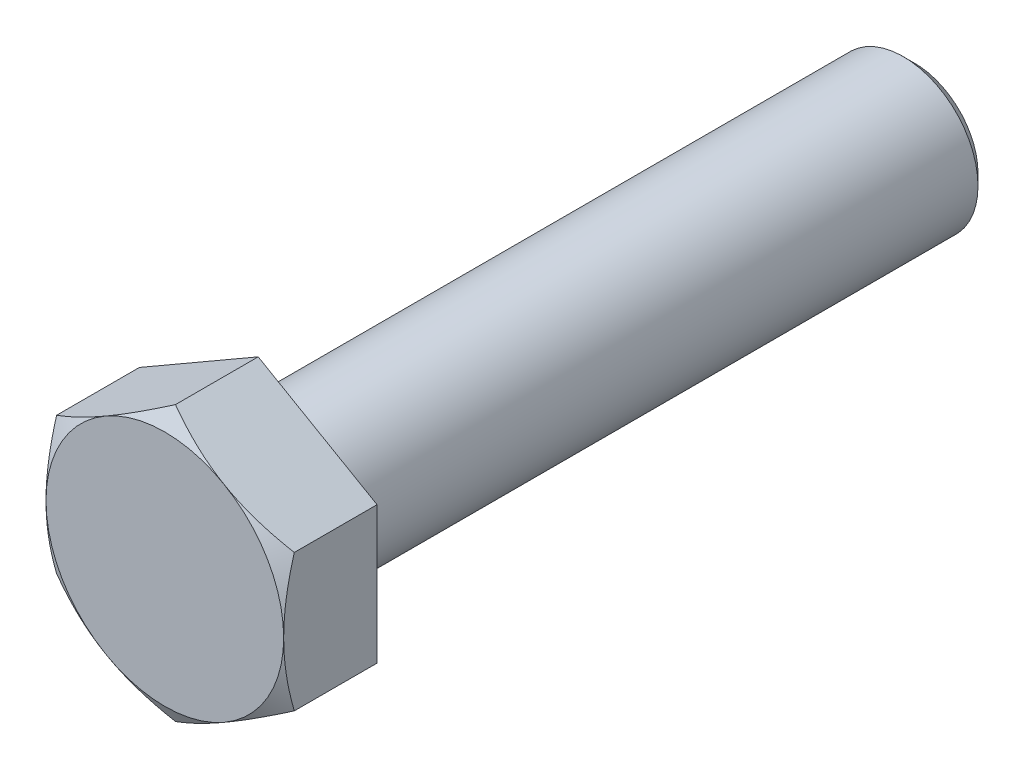
from build123d import *

# Parameters (mm, degrees)
BOSS_EXTRUDE1_DEPTH = 5.15


with BuildPart() as part:
    # Sketch1 → Boss-Extrude1 (new body)
    with BuildSketch(Plane.XY):
        Polygon((0, 7.349668927), (-6.365, 3.674834463), (-6.365, -3.674834463), (0, -7.349668927), (6.365, -3.674834463), (6.365, 3.674834463), align=None)
    extrude(amount=BOSS_EXTRUDE1_DEPTH)

    # Sketch2 → Revolve1 (revolve)
    with BuildSketch(Plane(origin=(0, 0, 0), x_dir=(0, 0, -1), z_dir=(1, 0, 0)), mode=Mode.PRIVATE) as revolve1_sk:
        with BuildLine():
            Line((0, 0), (0, 4.6))
            ThreePointArc((0, 4.6), (0.175735931, 4.175735931), (0.6, 4))
            Line((0.6, 4), (34.4, 4))
            Line((34.4, 4), (35, 3.4))
            Line((35, 3.4), (35, 0))
            Line((35, 0), (0, 0))
        make_face()
    revolve(revolve1_sk.sketch.rotate(Axis((0, 0, 0), (0, 0, -1)), 90), axis=Axis((0, 0, 0), (0, 0, -1)))

    # Sketch3 → Cut-Revolve1 (revolve, cut)
    with BuildSketch(Plane(origin=(0, 0, 0), x_dir=(0, 0, -1), z_dir=(1, 0, 0)), mode=Mode.PRIVATE) as cut_revolve1_sk:
        Polygon((-5.15, 7.349668927), (-4.58150113, 7.349668927), (-5.15, 6.365), align=None)
        Polygon((-0.15, 7.349668927), (-0.15, 5.88660254), (0, 5.8), (0, 7.349668927), align=None)
    revolve(cut_revolve1_sk.sketch.rotate(Axis((0, 0, 12.204941078), (0, 0, -1)), 90), axis=Axis((0, 0, 12.204941078), (0, 0, -1)), mode=Mode.SUBTRACT)


solid = part.part
